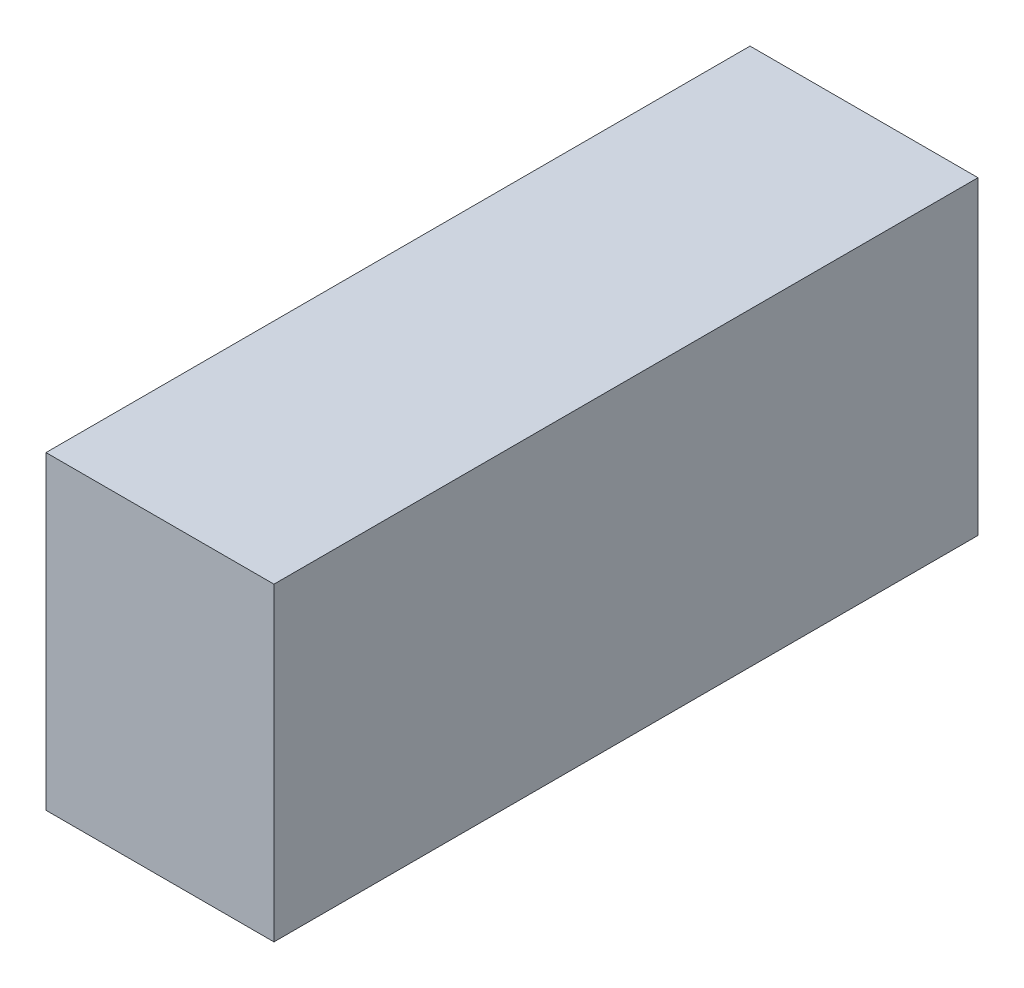
from build123d import *

# Parameters (mm, degrees)
SKETCH1_W           = 45.974
SKETCH1_H           = 141.986
BOSS_EXTRUDE1_DEPTH = 62.484


with BuildPart() as part:
    # Sketch1 → Boss-Extrude1 (new body)
    with BuildSketch(Plane(origin=(0, 0, 0), x_dir=(1, 0, 0), z_dir=(0, 1, 0))):
        with Locations((22.987, 70.993)):
            Rectangle(SKETCH1_W, SKETCH1_H)
    extrude(amount=BOSS_EXTRUDE1_DEPTH)


solid = part.part
